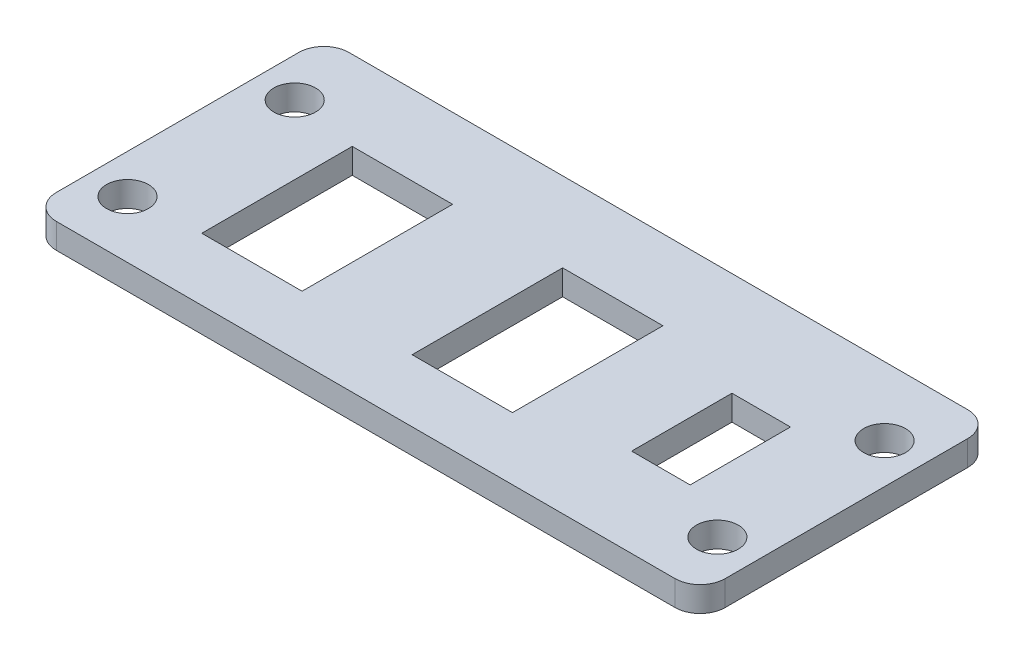
from build123d import *

# Parameters (mm, degrees)
SKETCH1_W           = 80
SKETCH1_H           = 35
SKETCH1_R           = 2.5
SKETCH1_W_2         = 12
SKETCH1_H_2         = 18
SKETCH1_W_3         = 7
SKETCH1_H_3         = 12
BOSS_EXTRUDE1_DEPTH = 3
FILLET1_R           = 3


with BuildPart() as part:
    # Sketch1 → Boss-Extrude1 (new body)
    with BuildSketch(Plane(origin=(0, 0, 0), x_dir=(1, 0, 0), z_dir=(0, 1, 0))):
        with Locations((311.134650114, -80.595715333)):
            Rectangle(SKETCH1_W, SKETCH1_H)
        with Locations(Location((275.818253153, -71.268297863, 0), (0, 0, 270))):
            Circle(SKETCH1_R, mode=Mode.SUBTRACT)
        with Locations(Location((275.818253153, -91.268297863, 0), (0, 0, 270))):
            Circle(SKETCH1_R, mode=Mode.SUBTRACT)
        with Locations(Location((346.370521359, -71.268297863, 0), (0, 0, 270))):
            Circle(SKETCH1_R, mode=Mode.SUBTRACT)
        with Locations(Location((346.370521359, -91.268297863, 0), (0, 0, 270))):
            Circle(SKETCH1_R, mode=Mode.SUBTRACT)
        with Locations((315.220523964, -81.629701497)):
            Rectangle(SKETCH1_W_2, SKETCH1_H_2, mode=Mode.SUBTRACT)
        with Locations((290.062529159, -81.629701497)):
            Rectangle(SKETCH1_W_2, SKETCH1_H_2, mode=Mode.SUBTRACT)
        with Locations((335.834815931, -81.489103707)):
            Rectangle(SKETCH1_W_3, SKETCH1_H_3, mode=Mode.SUBTRACT)
    extrude(amount=BOSS_EXTRUDE1_DEPTH)

    # Fillet1
    fillet1_edges = [part.edges().sort_by_distance(p)[0] for p in [
        (271.134650114, 1.5, 63.095715333),
        (351.134650114, 1.5, 63.095715333),
        (351.134650114, 1.5, 98.095715333),
        (271.134650114, 1.5, 98.095715333),
    ]]
    fillet(fillet1_edges, radius=FILLET1_R)


solid = part.part
